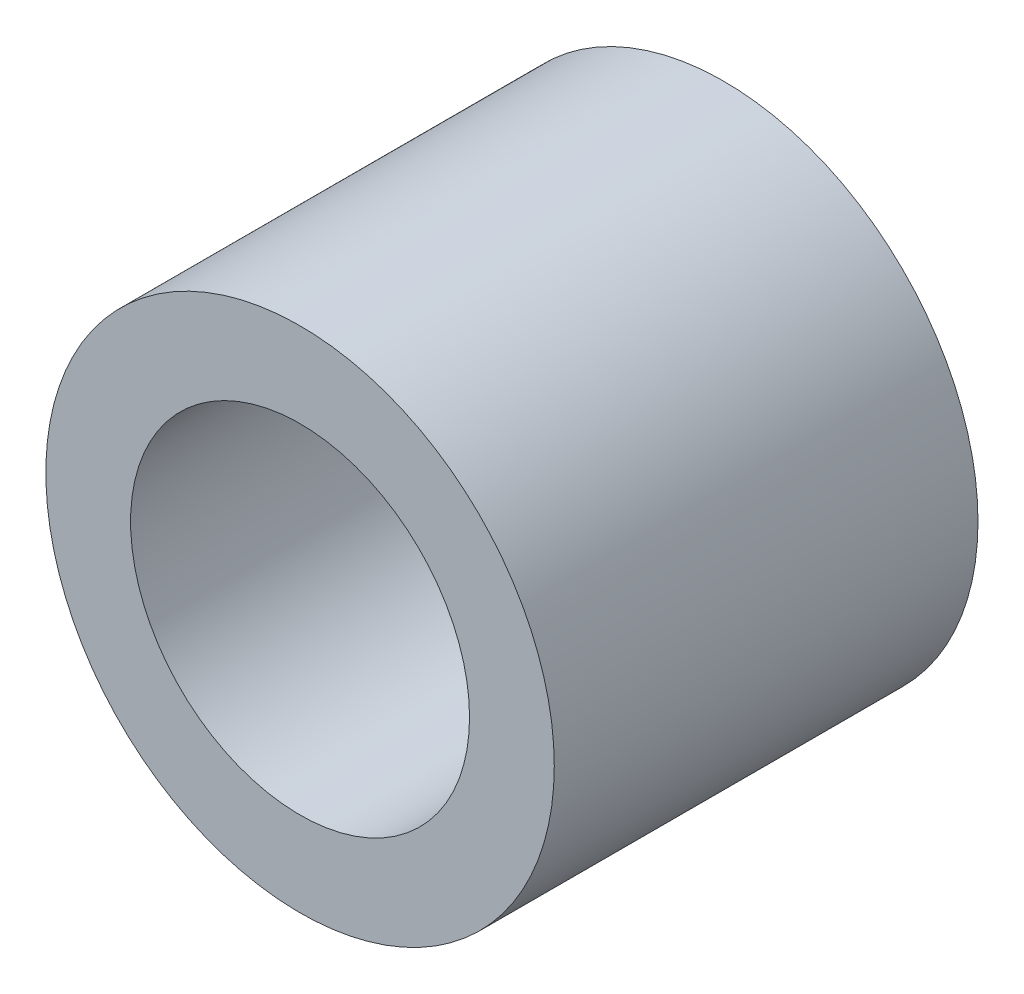
from build123d import *

# Parameters (mm, degrees)
SKETCH1_R           = 300
SKETCH1_R_2         = 200
BOSS_EXTRUDE2_DEPTH = 500


with BuildPart() as part:
    # Sketch1 → Boss-Extrude2 (new body)
    with BuildSketch(Plane.XY):
        Circle(SKETCH1_R)
        Circle(SKETCH1_R_2, mode=Mode.SUBTRACT)
    extrude(amount=BOSS_EXTRUDE2_DEPTH)


solid = part.part
